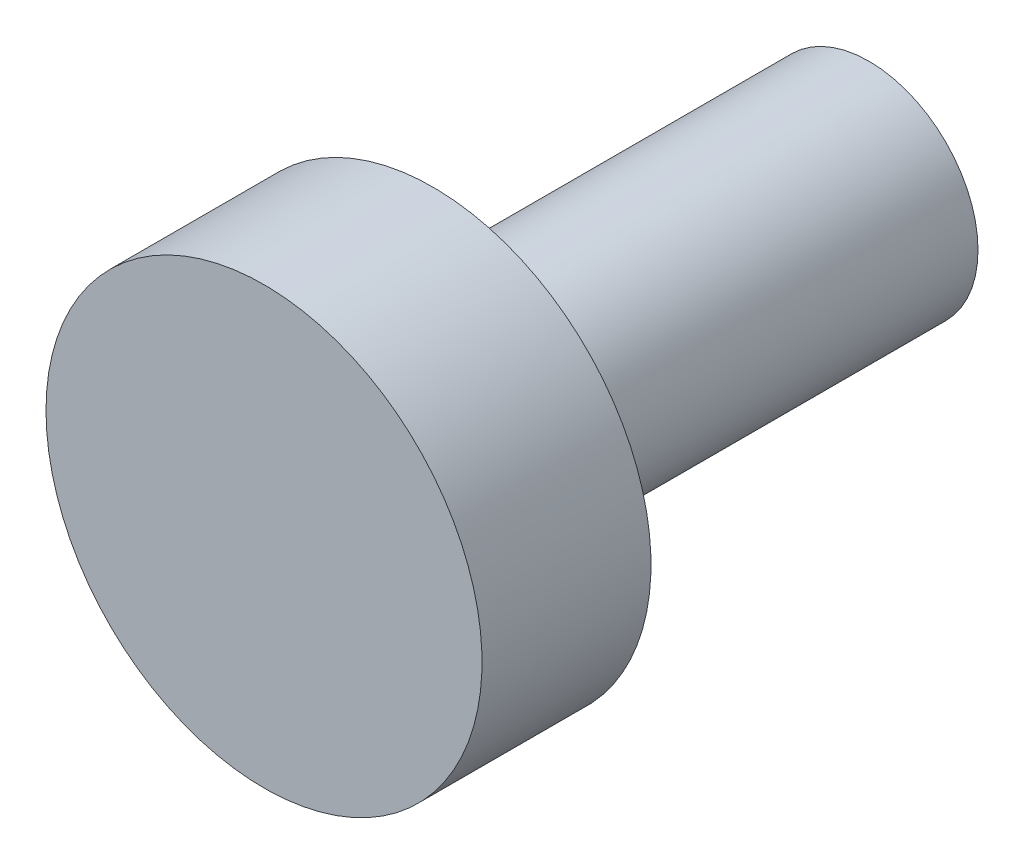
from build123d import *

# Parameters (mm, degrees)
ESQUISSE1_R        = 4
BOSS_EXTRU_1_DEPTH = 3.1
ESQUISSE2_R        = 2
BOSS_EXTRU_2_DEPTH = 8


with BuildPart() as part:
    # Esquisse1 → Boss.-Extru.1 (new body)
    with BuildSketch(Plane.XY):
        with Locations(Location((0, 0, 0), (0, 0, 180))):
            Circle(ESQUISSE1_R)
    extrude(amount=BOSS_EXTRU_1_DEPTH)

    # Esquisse2 → Boss.-Extru.2 (add)
    with BuildSketch(Plane(origin=(0, 0, 0), x_dir=(-1, 0, 0), z_dir=(0, 0, -1))):
        Circle(ESQUISSE2_R)
    extrude(amount=BOSS_EXTRU_2_DEPTH)


solid = part.part
